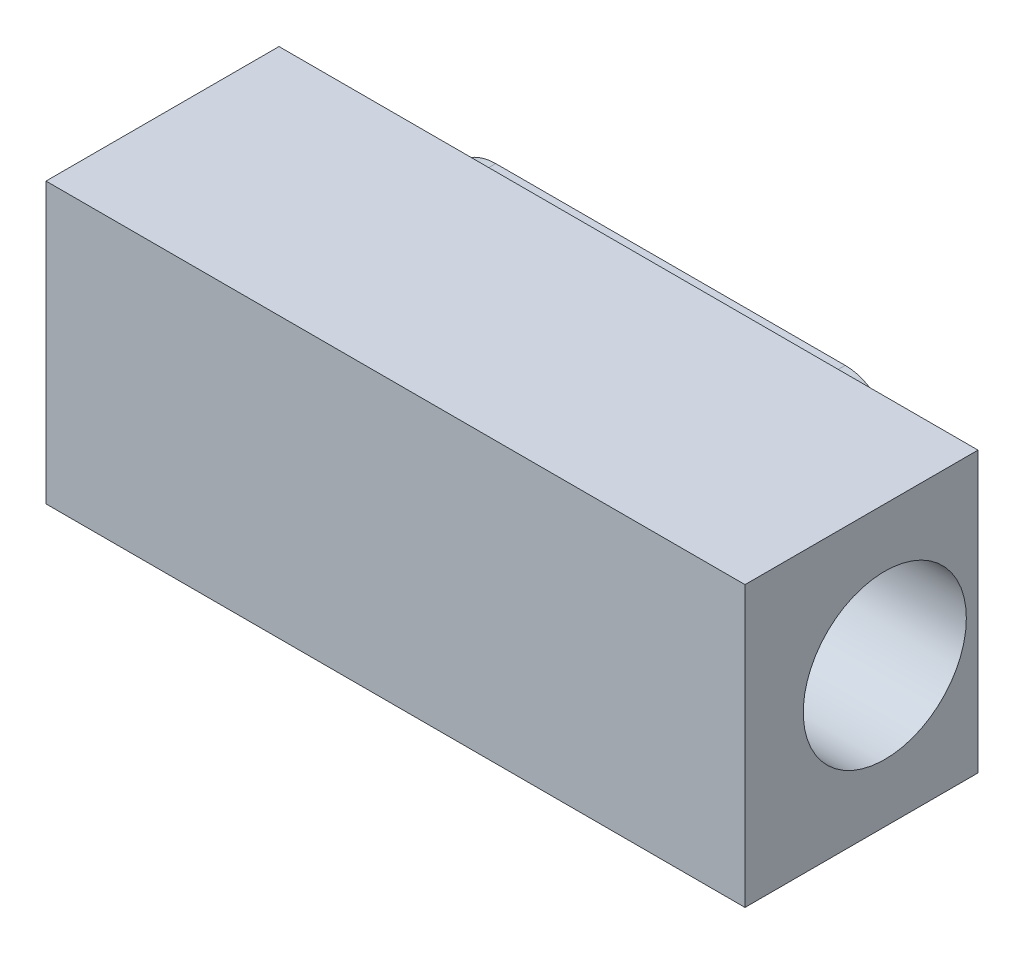
from build123d import *

# Parameters (mm, degrees)
P_IDAT_VYSUNUT_M1_DEPTH       = 1.8
SKICA2_W                      = 30
SKICA2_H                      = 12
P_IDAT_VYSUNUT_M2_DEPTH       = 10
SKICA3_R                      = 3.5
ODEBRAT_VYSUNUT_M1_DEPTH      = 20
ODEBRAT_VYSUNUT_M2_DEPTH      = 1
ODEBRAT_VYSUNUT_M2_DEPTH_BACK = 1.5
SKICA4_W                      = 16
SKICA4_H                      = 6


with BuildPart() as part:
    # Skica1 → Přidat vysunutím1 (new body)
    with BuildSketch(Plane.XY):
        with BuildLine():
            Line((-7.5, 4.5), (7.5, 4.5))
            ThreePointArc((7.5, 4.5), (8.914213562, 3.914213562), (9.5, 2.5))
            Line((9.5, 2.5), (9.5, -2.5))
            ThreePointArc((9.5, -2.5), (8.914213562, -3.914213562), (7.5, -4.5))
            Line((7.5, -4.5), (-7.5, -4.5))
            ThreePointArc((-7.5, -4.5), (-8.914213562, -3.914213562), (-9.5, -2.5))
            Line((-9.5, -2.5), (-9.5, 2.5))
            ThreePointArc((-9.5, 2.5), (-8.914213562, 3.914213562), (-7.5, 4.5))
        make_face()
    extrude(amount=P_IDAT_VYSUNUT_M1_DEPTH)

    # Skica2 → Přidat vysunutím2 (add)
    with BuildSketch(Plane.XY.offset(1.8)):
        Rectangle(SKICA2_W, SKICA2_H)
    extrude(amount=P_IDAT_VYSUNUT_M2_DEPTH)

    # Skica3 → Odebrat vysunutím1 (cut)
    with BuildSketch(Plane(origin=(15, 0, 0), x_dir=(0, 0, -1), z_dir=(1, 0, 0))):
        with Locations((-5.8, 0)):
            Circle(SKICA3_R)
    extrude(amount=-ODEBRAT_VYSUNUT_M1_DEPTH, mode=Mode.SUBTRACT)

    # Skica4 → Odebrat vysunutím2 (cut, two sides: drawn at the far end of the back side and taken through both)
    with BuildSketch(Plane(origin=(0, 0, 1.8), x_dir=(-1, 0, 0), z_dir=(0, 0, -1)).offset(-ODEBRAT_VYSUNUT_M2_DEPTH_BACK)):
        Rectangle(SKICA4_W, SKICA4_H)
    extrude(amount=ODEBRAT_VYSUNUT_M2_DEPTH + ODEBRAT_VYSUNUT_M2_DEPTH_BACK, mode=Mode.SUBTRACT)


solid = part.part
